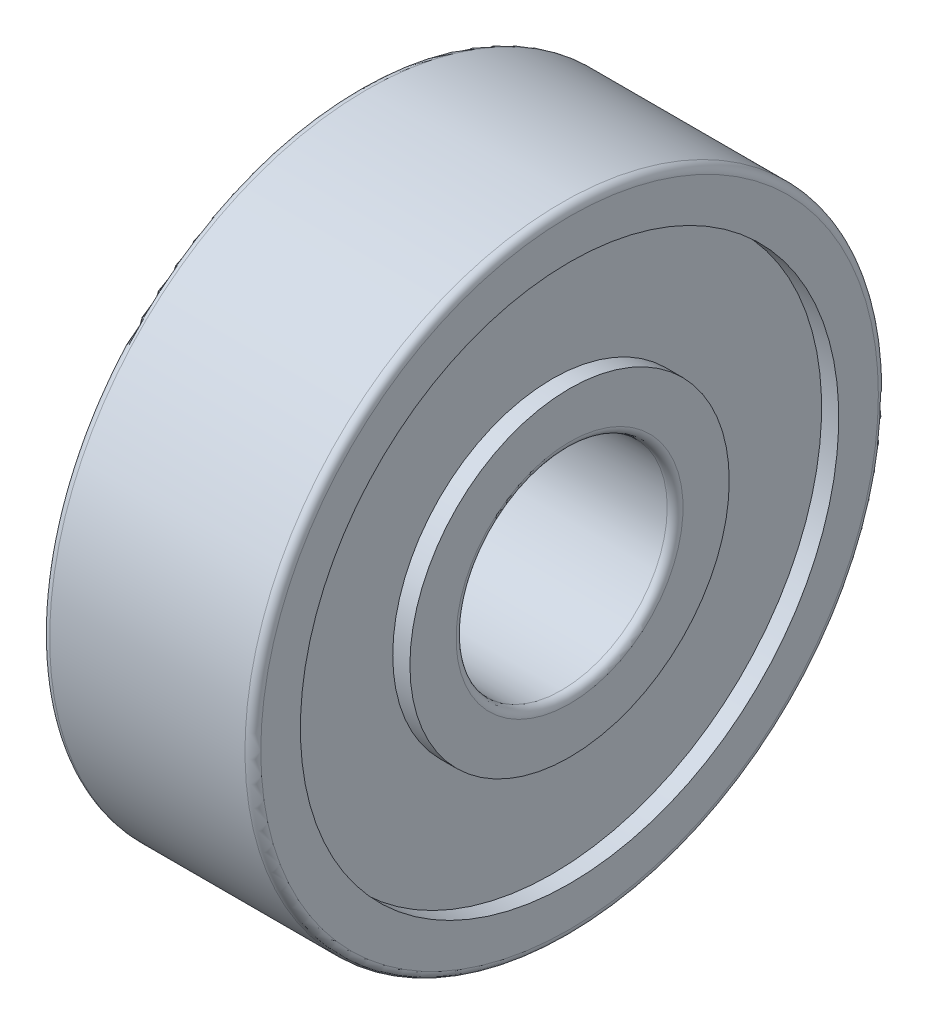
from build123d import *

# Parameters (mm, degrees)
FILLET1_R = 0.3


with BuildPart() as part:
    # Sketch1 → Revolve1 (revolve)
    with BuildSketch(Plane.XY, mode=Mode.PRIVATE) as revolve1_sk:
        Polygon((0, 4), (0, 6.05), (0.65, 6.05), (0.65, 10.2), (0, 10.2), (0, 12), (8, 12), (8, 10.2), (7.35, 10.2), (7.35, 6.05), (8, 6.05), (8, 4), align=None)
    revolve(revolve1_sk.sketch.rotate(Axis((0, 0, 0), (1, 0, 0)), 180), axis=Axis((0, 0, 0), (1, 0, 0)))

    # Fillet1
    fillet1_edges = [part.edges().sort_by_distance(p)[0] for p in [
        (8, 12, 0),
        (0, 12, 0),
        (0, 4, 0),
        (8, 4, 0),
    ]]
    fillet(fillet1_edges, radius=FILLET1_R)


solid = part.part
